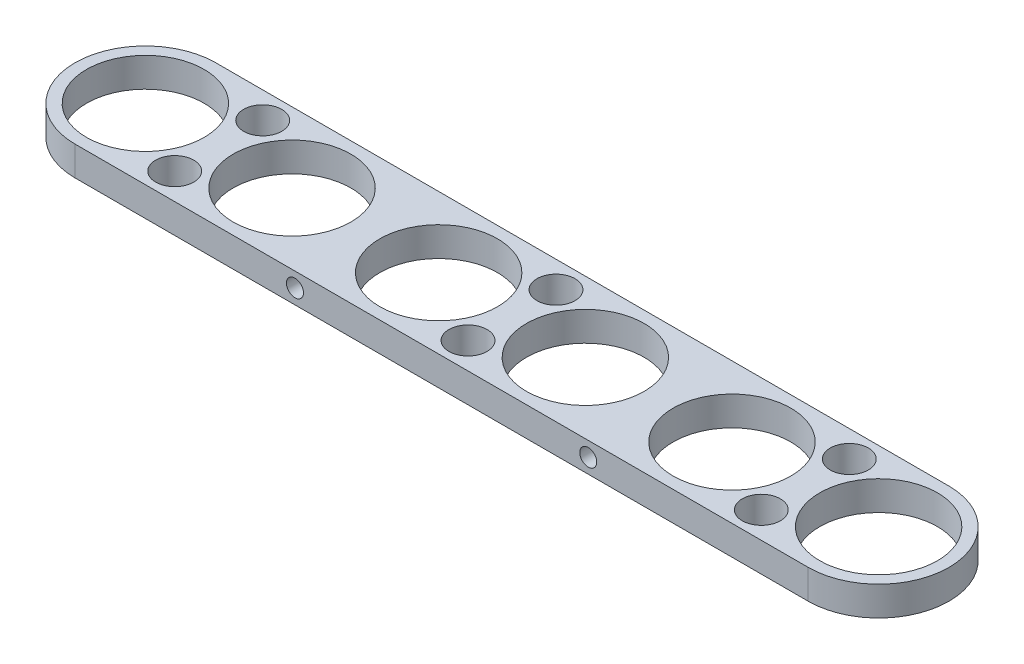
from build123d import *

# Parameters (mm, degrees)
SKETCH1_R           = 12.74408056
SKETCH1_R_2         = 4.1275
BOSS_EXTRUDE1_DEPTH = 6.35
SKETCH2_R           = 1.8415
CUT_EXTRUDE1_DEPTH  = 177.753707175


with BuildPart() as part:
    # Sketch1 → Boss-Extrude1 (new body)
    with BuildSketch(Plane(origin=(0, 0, 0), x_dir=(1, 0, 0), z_dir=(0, 1, 0))):
        with BuildLine():
            Line((0, -15.24), (158.75, -15.24))
            ThreePointArc((158.75, -15.24), (173.99, 0), (158.75, 15.24))
            Line((158.75, 15.24), (0, 15.24))
            ThreePointArc((0, 15.24), (-15.24, 0), (0, -15.24))
        make_face()
        with Locations(Location((0, 0, 0), (0, 0, 270))):
            Circle(SKETCH1_R, mode=Mode.SUBTRACT)
        with Locations(Location((31.75, 0, 0), (0, 0, 270))):
            Circle(SKETCH1_R, mode=Mode.SUBTRACT)
        with Locations(Location((63.5, 0, 0), (0, 0, 270))):
            Circle(SKETCH1_R, mode=Mode.SUBTRACT)
        with Locations(Location((95.25, 0, 0), (0, 0, 270))):
            Circle(SKETCH1_R, mode=Mode.SUBTRACT)
        with Locations(Location((127, 0, 0), (0, 0, 270))):
            Circle(SKETCH1_R, mode=Mode.SUBTRACT)
        with Locations(Location((158.75, 0, 0), (0, 0, 270))):
            Circle(SKETCH1_R, mode=Mode.SUBTRACT)
        with Locations(Location((15.875, -9.525, 0), (0, 0, 270))):
            Circle(SKETCH1_R_2, mode=Mode.SUBTRACT)
        with Locations(Location((15.875, 9.525, 0), (0, 0, 90))):
            Circle(SKETCH1_R_2, mode=Mode.SUBTRACT)
        with Locations(Location((79.375, 9.525, 0), (0, 0, 90))):
            Circle(SKETCH1_R_2, mode=Mode.SUBTRACT)
        with Locations(Location((79.375, -9.525, 0), (0, 0, 270))):
            Circle(SKETCH1_R_2, mode=Mode.SUBTRACT)
        with Locations(Location((142.875, 9.525, 0), (0, 0, 90))):
            Circle(SKETCH1_R_2, mode=Mode.SUBTRACT)
        with Locations(Location((142.875, -9.525, 0), (0, 0, 270))):
            Circle(SKETCH1_R_2, mode=Mode.SUBTRACT)
    extrude(amount=BOSS_EXTRUDE1_DEPTH)

    # Sketch2 → Cut-Extrude1 (cut, through all)
    with BuildSketch(Plane(origin=(0, 0, -15.24), x_dir=(-1, 0, 0), z_dir=(0, 0, -1))):
        with Locations((-111.125, 3.175)):
            Circle(SKETCH2_R)
        with Locations((-47.625, 3.175)):
            Circle(SKETCH2_R)
    extrude(amount=-CUT_EXTRUDE1_DEPTH, mode=Mode.SUBTRACT)


solid = part.part
